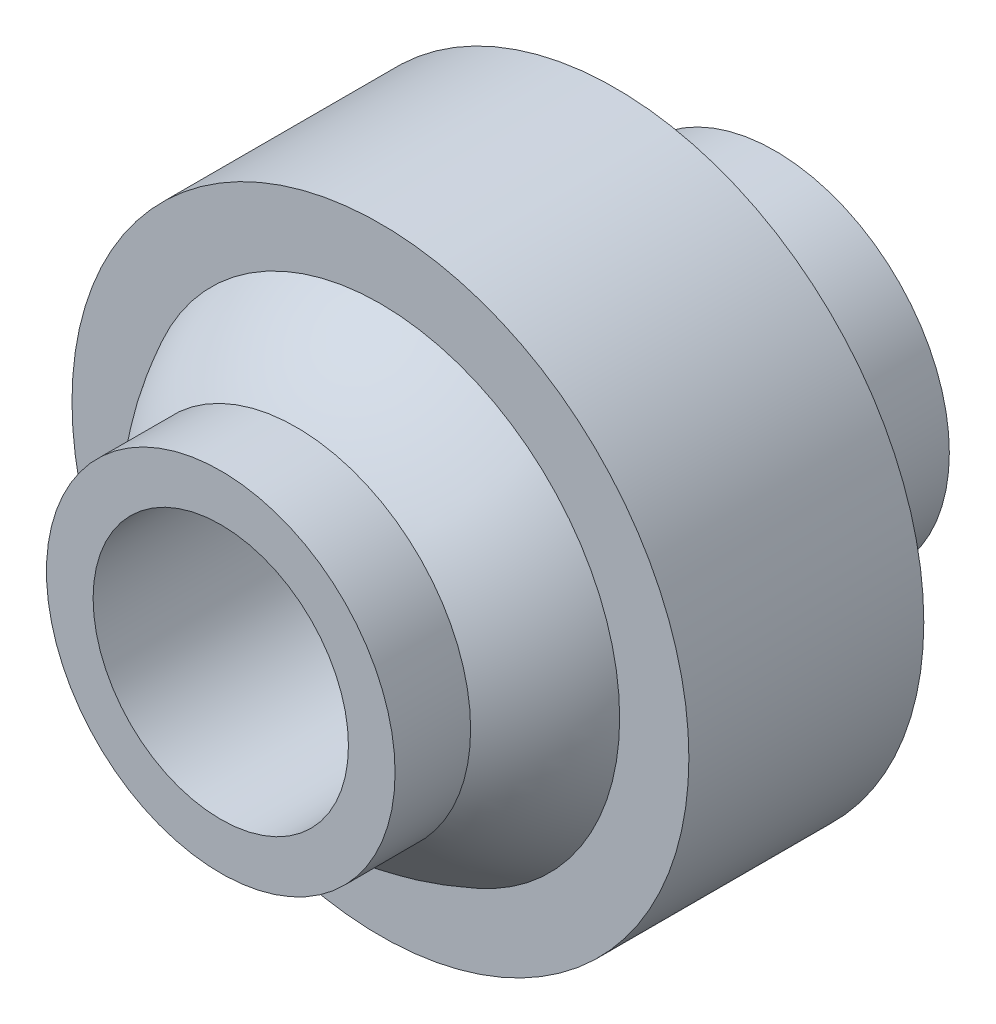
from build123d import *


with BuildPart() as part:
    # Sketch1 → Revolve1 (revolve)
    with BuildSketch(Plane(origin=(0, 0, 0), x_dir=(0, 0, -1), z_dir=(1, 0, 0)), mode=Mode.PRIVATE) as revolve1_sk:
        with BuildLine():
            Line((60.7822, -26.811732), (81.4578, -26.811732))
            Line((81.4578, -26.811732), (81.4578, -28.551632))
            Line((81.4578, -28.551632), (78.639993039, -28.551632))
            ThreePointArc((78.639993039, -28.551632), (77.1926569, -29.920339878), (75.5015, -30.973018125))
            Line((75.5015, -30.973018125), (75.5015, -33.555432))
            Line((75.5015, -33.555432), (66.7385, -33.555432))
            Line((66.7385, -33.555432), (66.7385, -30.973018125))
            ThreePointArc((66.7385, -30.973018125), (65.0473431, -29.920339878), (63.600006961, -28.551632))
            Line((63.600006961, -28.551632), (60.7822, -28.551632))
            Line((60.7822, -28.551632), (60.7822, -26.811732))
        make_face()
    revolve(revolve1_sk.sketch.rotate(Axis((0, -22.049232, -82.136173087), (0, 0, -1)), 270), axis=Axis((0, -22.049232, -82.136173087), (0, 0, -1)))


solid = part.part
